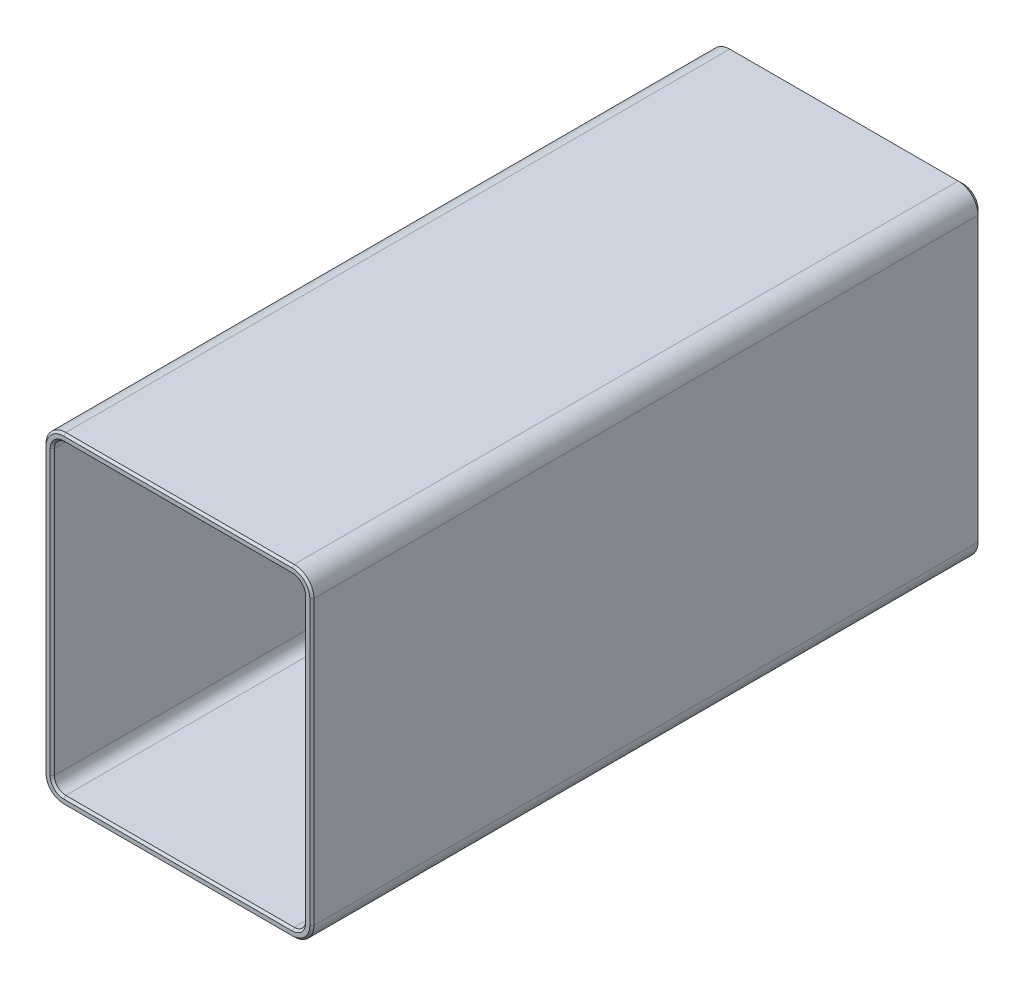
from build123d import *

# Parameters (mm, degrees)
WALLS_DEPTH            = 129
FLOOR_2_DEPTH          = 2.6
BOTTOM_CHAMFERS_SIZE   = 1
TOP_CHAMFERS_SIZE      = 0.4
INSIDE_BOTTOM_FILLET_R = 1


with BuildPart() as part:
    # Sketch1 → Walls (new body)
    with BuildSketch(Plane.XY):
        with BuildLine():
            Line((-25.75, 27.2), (-25.75, -27.2))
            ThreePointArc((-25.75, -27.2), (-24.637005769, -29.887005769), (-21.95, -31))
            Line((-21.95, -31), (21.95, -31))
            ThreePointArc((21.95, -31), (24.637005769, -29.887005769), (25.75, -27.2))
            Line((25.75, -27.2), (25.75, 27.2))
            ThreePointArc((25.75, 27.2), (24.637005769, 29.887005769), (21.95, 31))
            Line((21.95, 31), (-21.95, 31))
            ThreePointArc((-21.95, 31), (-24.637005769, 29.887005769), (-25.75, 27.2))
        make_face()
        with BuildLine():
            Line((-24.15, 27.2), (-24.15, -27.2))
            ThreePointArc((-24.15, -27.2), (-23.505634919, -28.755634919), (-21.95, -29.4))
            Line((-21.95, -29.4), (21.95, -29.4))
            ThreePointArc((21.95, -29.4), (23.505634919, -28.755634919), (24.15, -27.2))
            Line((24.15, -27.2), (24.15, 27.2))
            ThreePointArc((24.15, 27.2), (23.505634919, 28.755634919), (21.95, 29.4))
            Line((21.95, 29.4), (-21.95, 29.4))
            ThreePointArc((-21.95, 29.4), (-23.505634919, 28.755634919), (-24.15, 27.2))
        make_face(mode=Mode.SUBTRACT)
    extrude(amount=WALLS_DEPTH)

    # Sketch2 → Floor 2 (add)
    with BuildSketch(Plane(origin=(0, 0, 0), x_dir=(-1, 0, 0), z_dir=(0, 0, -1))):
        with BuildLine():
            Line((-25.75, 27.2), (-25.75, -27.2))
            ThreePointArc((-25.75, -27.2), (-24.637005769, -29.887005769), (-21.95, -31))
            Line((-21.95, -31), (21.95, -31))
            ThreePointArc((21.95, -31), (24.637005769, -29.887005769), (25.75, -27.2))
            Line((25.75, -27.2), (25.75, 27.2))
            ThreePointArc((25.75, 27.2), (24.637005769, 29.887005769), (21.95, 31))
            Line((21.95, 31), (-21.95, 31))
            ThreePointArc((-21.95, 31), (-24.637005769, 29.887005769), (-25.75, 27.2))
        make_face()
    extrude(amount=-FLOOR_2_DEPTH)

    # Bottom Chamfers
    bottom_chamfers_edges = [part.edges().sort_by_distance(p)[0] for p in [
        (25.75, 0, 0),
        (24.637005769, -29.887005769, 0),
        (0, -31, 0),
        (-24.637005769, -29.887005769, 0),
        (-25.75, 0, 0),
        (-24.637005769, 29.887005769, 0),
        (0, 31, 0),
        (24.637005769, 29.887005769, 0),
    ]]
    chamfer(bottom_chamfers_edges, length=BOTTOM_CHAMFERS_SIZE)

    # Top Chamfers
    top_chamfers_edges = [part.edges().sort_by_distance(p)[0] for p in [
        (-24.637005769, 29.887005769, 129),
        (-25.75, 0, 129),
        (-24.637005769, -29.887005769, 129),
        (0, -31, 129),
        (23.505634919, 28.755634919, 129),
        (0, 29.4, 129),
        (-23.505634919, 28.755634919, 129),
        (-24.15, 0, 129),
        (-23.505634919, -28.755634919, 129),
        (24.637005769, -29.887005769, 129),
        (0, -29.4, 129),
        (23.505634919, -28.755634919, 129),
        (24.15, 0, 129),
        (25.75, 0, 129),
        (24.637005769, 29.887005769, 129),
        (0, 31, 129),
    ]]
    chamfer(top_chamfers_edges, length=TOP_CHAMFERS_SIZE)

    # Inside Bottom Fillet
    inside_bottom_fillet_edges = [part.edges().sort_by_distance(p)[0] for p in [
        (24.15, 0, 2.6),
        (0, 29.4, 2.6),
        (23.505634919, 28.755634919, 2.6),
        (23.505634919, -28.755634919, 2.6),
        (0, -29.4, 2.6),
        (-23.505634919, -28.755634919, 2.6),
        (-24.15, 0, 2.6),
        (-23.505634919, 28.755634919, 2.6),
    ]]
    fillet(inside_bottom_fillet_edges, radius=INSIDE_BOTTOM_FILLET_R)


solid = part.part
